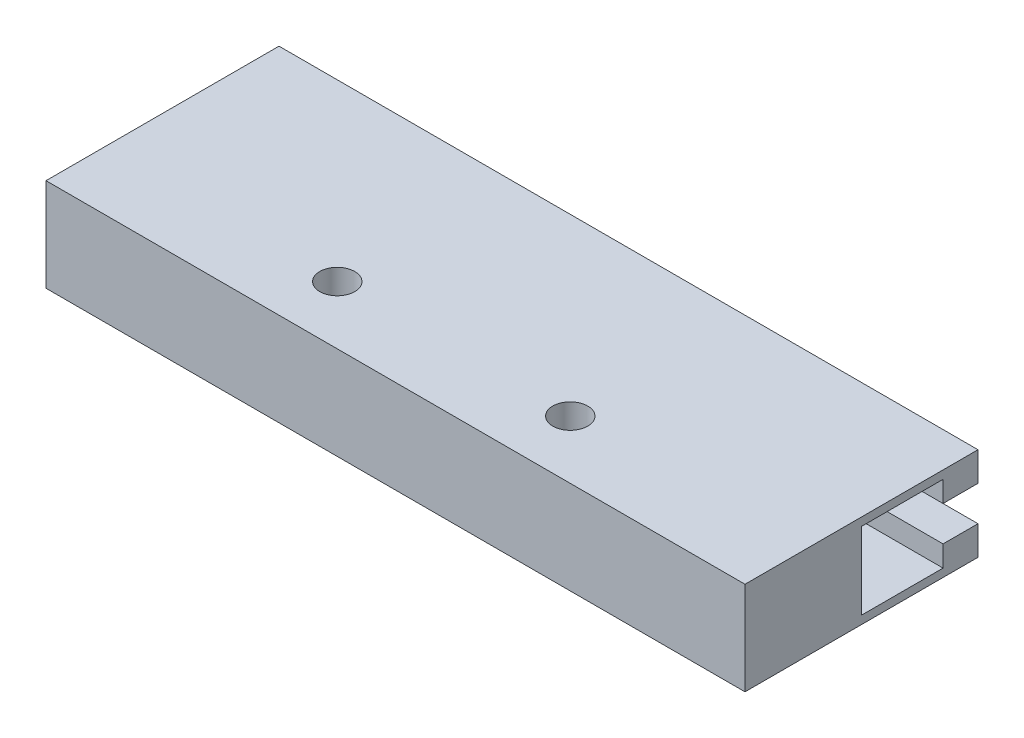
from build123d import *

# Parameters (mm, degrees)
SKETCH1_W           = 60
SKETCH1_H           = 8
BOSS_EXTRUDE1_DEPTH = 20
CUT_EXTRUDE1_DEPTH  = 64.749509802
SKETCH4_R           = 1.5
CUT_EXTRUDE2_DEPTH  = 64.749509802


with BuildPart() as part:
    # Sketch1 → Boss-Extrude1 (new body)
    with BuildSketch(Plane.XY):
        with Locations((30, -4)):
            Rectangle(SKETCH1_W, SKETCH1_H)
    extrude(amount=BOSS_EXTRUDE1_DEPTH)

    # Sketch2 → Cut-Extrude1 (cut, through all)
    with BuildSketch(Plane(origin=(60, 0, 0), x_dir=(0, 0, -1), z_dir=(1, 0, 0))):
        Polygon((0, -4), (0, -2.5), (-3, -2.5), (-3, -0.7), (-10, -0.7), (-10, -7.3), (-3, -7.3), (-3, -5.5), (0, -5.5), align=None)
    extrude(amount=-CUT_EXTRUDE1_DEPTH, mode=Mode.SUBTRACT)

    # Sketch4 → Cut-Extrude2 (cut, through all)
    with BuildSketch(Plane(origin=(0, 0, 0), x_dir=(1, 0, 0), z_dir=(0, 1, 0))):
        with Locations(Location((40, -15, 0), (0, 0, 270))):
            Circle(SKETCH4_R)
        with Locations(Location((20, -15, 0), (0, 0, 270))):
            Circle(SKETCH4_R)
    extrude(amount=-CUT_EXTRUDE2_DEPTH, mode=Mode.SUBTRACT)


solid = part.part
